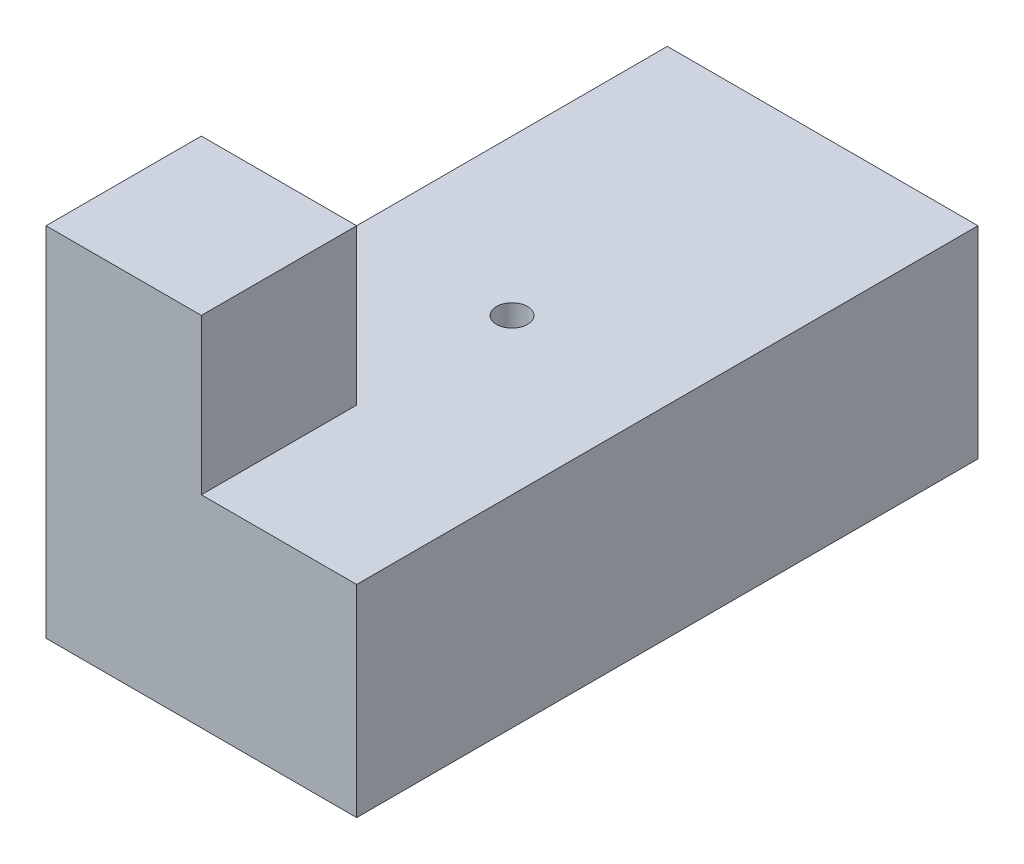
from build123d import *

# Parameters (mm, degrees)
SKETCH1_W                  = 100
SKETCH1_H                  = 200
BOSS_EXTRUDE1_DEPTH        = 65
F_10_0MM_DOWEL_HOLE1_D     = 10
F_10_0MM_DOWEL_HOLE1_DEPTH = 40
F_10_0MM_DOWEL_HOLE1_TIP   = 3.004303095
SKETCH5_W                  = 50
SKETCH5_H                  = 50
BOSS_EXTRUDE2_DEPTH        = 50


with BuildPart() as part:
    # Sketch1 → Boss-Extrude1 (new body)
    with BuildSketch(Plane(origin=(0, 0, 0), x_dir=(1, 0, 0), z_dir=(0, 1, 0))):
        with Locations((50, 100)):
            Rectangle(SKETCH1_W, SKETCH1_H)
    extrude(amount=BOSS_EXTRUDE1_DEPTH)

    # Ø10.0mm Dowel Hole1
    with Locations(Plane(origin=(0, 65, 0), x_dir=(1, 0, 0), z_dir=(0, 1, 0))):
        with Locations((50, 100)):
            Hole(F_10_0MM_DOWEL_HOLE1_D / 2, depth=F_10_0MM_DOWEL_HOLE1_DEPTH)
            with Locations((0, 0, -(F_10_0MM_DOWEL_HOLE1_DEPTH + F_10_0MM_DOWEL_HOLE1_TIP / 2))):  # 118° drill point
                Cone(0, F_10_0MM_DOWEL_HOLE1_D / 2, F_10_0MM_DOWEL_HOLE1_TIP, mode=Mode.SUBTRACT)

    # Sketch5 → Boss-Extrude2 (add)
    with BuildSketch(Plane(origin=(0, 65, 0), x_dir=(1, 0, 0), z_dir=(0, 1, 0))):
        with Locations((25, 25)):
            Rectangle(SKETCH5_W, SKETCH5_H)
    extrude(amount=BOSS_EXTRUDE2_DEPTH)


solid = part.part
